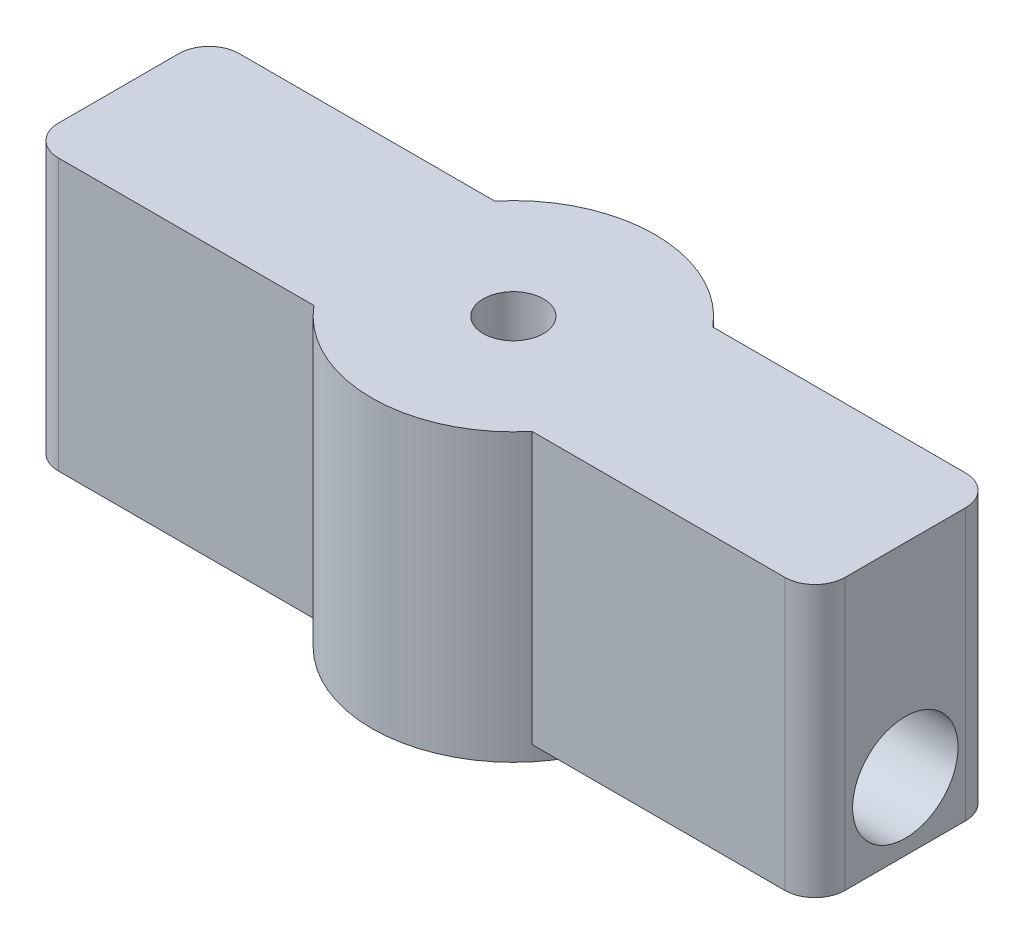
from build123d import *

# Parameters (mm, degrees)
SKETCH1_R           = 4.7
SKETCH1_R_2         = 2.5
BOSS_EXTRUDE1_DEPTH = 5
SKETCH2_R           = 4.7
BOSS_EXTRUDE2_DEPTH = 4.5
SKETCH3_R           = 1
CUT_EXTRUDE1_DEPTH  = 4.5
SKETCH6_W           = 6
SKETCH6_H           = 6
BOSS_EXTRUDE3_DEPTH = 8.31
SKETCH7_W           = 6
SKETCH7_H           = 6
BOSS_EXTRUDE4_DEPTH = 2
FILLET1_R           = 1
BOSS_EXTRUDE5_DEPTH = 3
BOSS_EXTRUDE6_DEPTH = 9
FILLET2_R           = 1
SKETCH8_R           = 1.75
CUT_EXTRUDE6_DEPTH  = 37


with BuildPart() as part:
    # Sketch1 → Boss-Extrude1 (new body)
    with BuildSketch(Plane(origin=(0, 0, 0), x_dir=(1, 0, 0), z_dir=(0, 1, 0))):
        with Locations(Location((0, 0, 0), (0, 0, 270))):
            Circle(SKETCH1_R)
        with Locations(Location((0, 0, 0), (0, 0, 270))):
            Circle(SKETCH1_R_2, mode=Mode.SUBTRACT)
    extrude(amount=BOSS_EXTRUDE1_DEPTH)

    # Sketch2 → Boss-Extrude2 (add)
    with BuildSketch(Plane(origin=(0, 5, 0), x_dir=(1, 0, 0), z_dir=(0, 1, 0))):
        with Locations(Location((0, 0, 0), (0, 0, 270))):
            Circle(SKETCH2_R)
    extrude(amount=BOSS_EXTRUDE2_DEPTH)

    # Sketch3 → Cut-Extrude1 (cut)
    with BuildSketch(Plane(origin=(0, 9.5, 0), x_dir=(1, 0, 0), z_dir=(0, 1, 0))):
        with Locations(Location((0, 0, 0), (0, 0, 270))):
            Circle(SKETCH3_R)
    extrude(amount=-CUT_EXTRUDE1_DEPTH, mode=Mode.SUBTRACT)



with BuildPart() as body_2:
    # Sketch6 → Boss-Extrude3 (new body)
    with BuildSketch(Plane(origin=(4.7, 0, 0), x_dir=(0, 0, -1), z_dir=(1, 0, 0))):
        with Locations((0, 3.5)):
            Rectangle(SKETCH6_W, SKETCH6_H)
    extrude(amount=BOSS_EXTRUDE3_DEPTH)


with BuildPart() as part_1:
    add(part.part)

    add(body_2.part)  # Boss-Extrude4 merges body 2
    # Sketch7 → Boss-Extrude4 (add)
    with BuildSketch(Plane.ZY.offset(-4.7)):
        with Locations((0, 3.5)):
            Rectangle(SKETCH7_W, SKETCH7_H)
    extrude(amount=BOSS_EXTRUDE4_DEPTH)

    # Fillet1
    fillet1_edges = [part_1.edges().sort_by_distance(p)[0] for p in [
        (13.01, 3.5, -3),
        (13.01, 3.5, 3),
    ]]
    fillet(fillet1_edges, radius=FILLET1_R)

    # Sketch9 → Boss-Extrude5 (add)
    with BuildSketch(Plane(origin=(0, 6.5, 0), x_dir=(1, 0, 0), z_dir=(0, 1, 0))):
        with BuildLine():
            Line((13.01, -2), (13.01, 2))
            ThreePointArc((13.01, 2), (12.717106781, 2.707106781), (12.01, 3))
            Line((12.01, 3), (3.618010503, 3))
            ThreePointArc((3.618010503, 3), (4.7, 0), (3.618010503, -3))
            Line((3.618010503, -3), (12.01, -3))
            ThreePointArc((12.01, -3), (12.717106781, -2.707106781), (13.01, -2))
        make_face()
    extrude(amount=BOSS_EXTRUDE5_DEPTH)

    # Sketch10 → Boss-Extrude6 (add)
    with BuildSketch(Plane(origin=(0, 9.5, 0), x_dir=(1, 0, 0), z_dir=(0, 1, 0))):
        with BuildLine():
            Line((-13.1, -3), (-3.354101966, -3))
            ThreePointArc((-3.354101966, -3), (-4.5, 0), (-3.354101966, 3))
            Line((-3.354101966, 3), (-13.1, 3))
            Line((-13.1, 3), (-13.1, -3))
        make_face()
    extrude(amount=-BOSS_EXTRUDE6_DEPTH)

    # Fillet2
    fillet2_edges = [part_1.edges().sort_by_distance(p)[0] for p in [
        (-13.1, 5, -3),
        (-13.1, 5, 3),
    ]]
    fillet(fillet2_edges, radius=FILLET2_R)

    # Sketch8 → Cut-Extrude6 (cut)
    with BuildSketch(Plane(origin=(13.01, 0, 0), x_dir=(0, 0, -1), z_dir=(1, 0, 0))):
        with Locations((0, 2.75)):
            Circle(SKETCH8_R)
    extrude(amount=-CUT_EXTRUDE6_DEPTH, mode=Mode.SUBTRACT)


solid = part_1.part
